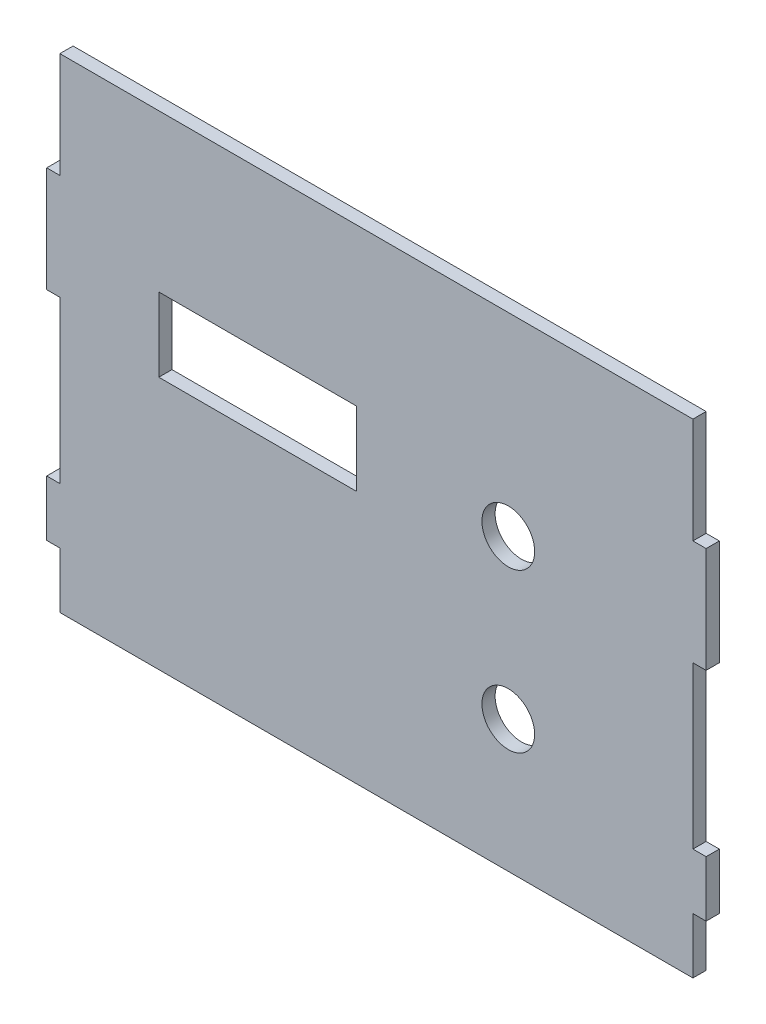
from build123d import *

# Parameters (mm, degrees)
ESQUISSE1_R        = 10
ESQUISSE1_W        = 75
ESQUISSE1_H        = 28
BOSS_EXTRU_1_DEPTH = 5


with BuildPart() as part:
    # Esquisse1 → Boss.-Extru.1 (new body)
    with BuildSketch(Plane.XY):
        Polygon((0, 143.5), (0, 183.5), (240, 183.5), (240, 143.5), (245, 143.5), (245, 103.5), (240, 103.5), (240, 42.333333333), (245, 42.333333333), (245, 21.166666667), (240, 21.166666667), (240, 0), (0, 0), (0, 21.166666667), (-5, 21.166666667), (-5, 42.333333333), (0, 42.333333333), (0, 103.5), (-5, 103.5), (-5, 143.5), align=None)
        with Locations((170, 110)):
            Circle(ESQUISSE1_R, mode=Mode.SUBTRACT)
        with Locations((170, 50)):
            Circle(ESQUISSE1_R, mode=Mode.SUBTRACT)
        with Locations((75, 110)):
            Rectangle(ESQUISSE1_W, ESQUISSE1_H, mode=Mode.SUBTRACT)
    extrude(amount=BOSS_EXTRU_1_DEPTH)


solid = part.part
